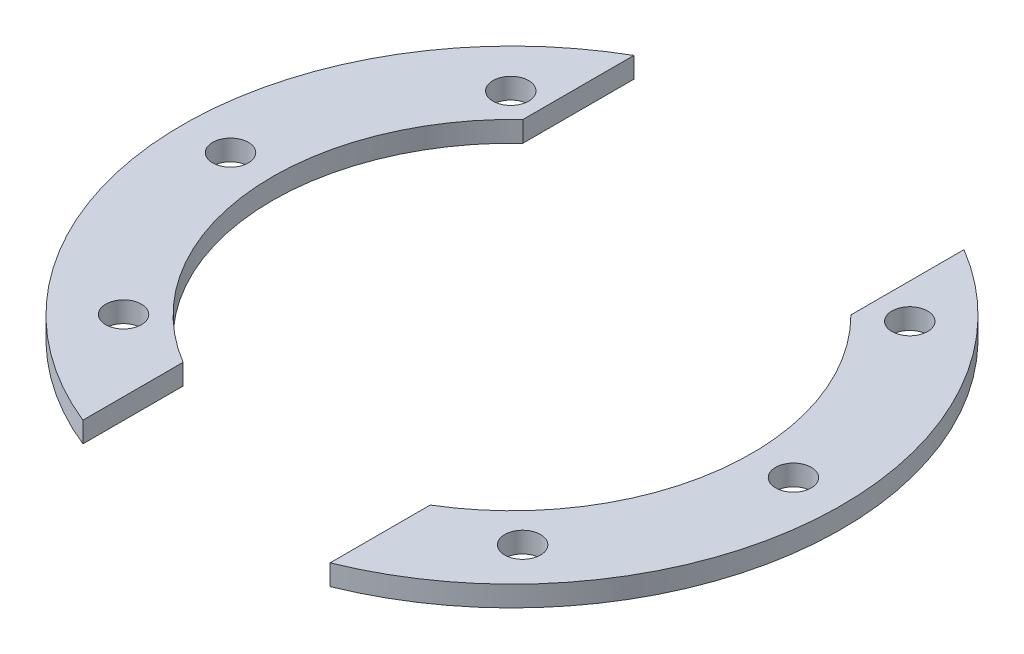
from build123d import *

# Parameters (mm, degrees)
SKETCH_1_R      = 2.3
SKETCH_1_R_2    = 1.3
EXTRUDE_1_DEPTH = 1.5


with BuildPart() as part:
    # 草图1 → 凸台-拉伸1 (new body)
    # profile 1 of 8: a face of its own
    with BuildSketch(Plane(origin=(0, 0, 0), x_dir=(1, 0, 0), z_dir=(0, 1, 0))):
        with BuildLine():
            Line((-9, -22.248595461), (-9, -14.954449778))
            ThreePointArc((-9, -14.954449778), (-17.356224893, -1.843102181), (-11.939965885, 12.73078092))
            Line((-11.939965885, 12.73078092), (-11.939965885, 13.609247836))
            ThreePointArc((-11.939965885, 13.609247836), (-16.487, 14.1), (-11.939965885, 14.590752164))
            Line((-11.939965885, 14.590752164), (-11.939965885, 20.819154994))
            ThreePointArc((-11.939965885, 20.819154994), (-23.944275415, -1.634525883), (-9, -22.248595461))
        make_face()
        with Locations((-14.187, -14.1)):
            Circle(SKETCH_1_R, mode=Mode.SUBTRACT)
        with Locations((-20.498, 0)):
            Circle(SKETCH_1_R, mode=Mode.SUBTRACT)
    # profile 2 of 8: a face of its own
    with BuildSketch(Plane(origin=(0, 0, 0), x_dir=(1, 0, 0), z_dir=(0, 1, 0))):
        with BuildLine():
            Line((12.327725044, 20.59192063), (12.327725044, 12.355677376))
            ThreePointArc((12.327725044, 12.355677376), (17.325666659, -2.111123633), (9, -14.954449778))
            Line((9, -14.954449778), (9, -22.248595461))
            ThreePointArc((9, -22.248595461), (19.899748742, -13.416407865), (24, 0))
            ThreePointArc((24, 0), (20.879001426, 11.835003146), (12.327725044, 20.59192063))
        make_face()
        with Locations((14.872, -14.097)):
            Circle(SKETCH_1_R, mode=Mode.SUBTRACT)
        with Locations((20.498, 0)):
            Circle(SKETCH_1_R, mode=Mode.SUBTRACT)
        with Locations((14.872, 14.097)):
            Circle(SKETCH_1_R, mode=Mode.SUBTRACT)
    # profile 3 of 8: a face of its own
    with BuildSketch(Plane(origin=(0, 0, 0), x_dir=(1, 0, 0), z_dir=(0, 1, 0))):
        with BuildLine():
            ThreePointArc((-11.939965885, 14.590752164), (-16.487, 14.1), (-11.939965885, 13.609247836))
            Line((-11.939965885, 13.609247836), (-11.939965885, 14.590752164))
        make_face()
        with Locations(Location((-14.187, 14.1, 0), (0, 0, 270))):
            Circle(SKETCH_1_R_2, mode=Mode.SUBTRACT)
    # profile 4 of 8: a face of its own
    with BuildSketch(Plane(origin=(0, 0, 0), x_dir=(1, 0, 0), z_dir=(0, 1, 0))):
        with Locations((-20.498, 0)):
            Circle(SKETCH_1_R)
        with Locations(Location((-20.498, 0, 0), (0, 0, 270))):
            Circle(SKETCH_1_R_2, mode=Mode.SUBTRACT)
    # profile 5 of 8: a face of its own
    with BuildSketch(Plane(origin=(0, 0, 0), x_dir=(1, 0, 0), z_dir=(0, 1, 0))):
        with Locations((-14.187, -14.1)):
            Circle(SKETCH_1_R)
        with Locations(Location((-14.187, -14.1, 0), (0, 0, 270))):
            Circle(SKETCH_1_R_2, mode=Mode.SUBTRACT)
    # profile 6 of 8: a face of its own
    with BuildSketch(Plane(origin=(0, 0, 0), x_dir=(1, 0, 0), z_dir=(0, 1, 0))):
        with Locations((20.498, 0)):
            Circle(SKETCH_1_R)
        with Locations(Location((20.498, 0, 0), (0, 0, 270))):
            Circle(SKETCH_1_R_2, mode=Mode.SUBTRACT)
    # profile 7 of 8: a face of its own
    with BuildSketch(Plane(origin=(0, 0, 0), x_dir=(1, 0, 0), z_dir=(0, 1, 0))):
        with Locations((14.872, 14.097)):
            Circle(SKETCH_1_R)
        with Locations(Location((14.872, 14.097, 0), (0, 0, 270))):
            Circle(SKETCH_1_R_2, mode=Mode.SUBTRACT)
    # profile 8 of 8: a face of its own
    with BuildSketch(Plane(origin=(0, 0, 0), x_dir=(1, 0, 0), z_dir=(0, 1, 0))):
        with Locations((14.872, -14.097)):
            Circle(SKETCH_1_R)
        with Locations(Location((14.872, -14.097, 0), (0, 0, 270))):
            Circle(SKETCH_1_R_2, mode=Mode.SUBTRACT)
    extrude(amount=EXTRUDE_1_DEPTH)


solid = part.part
